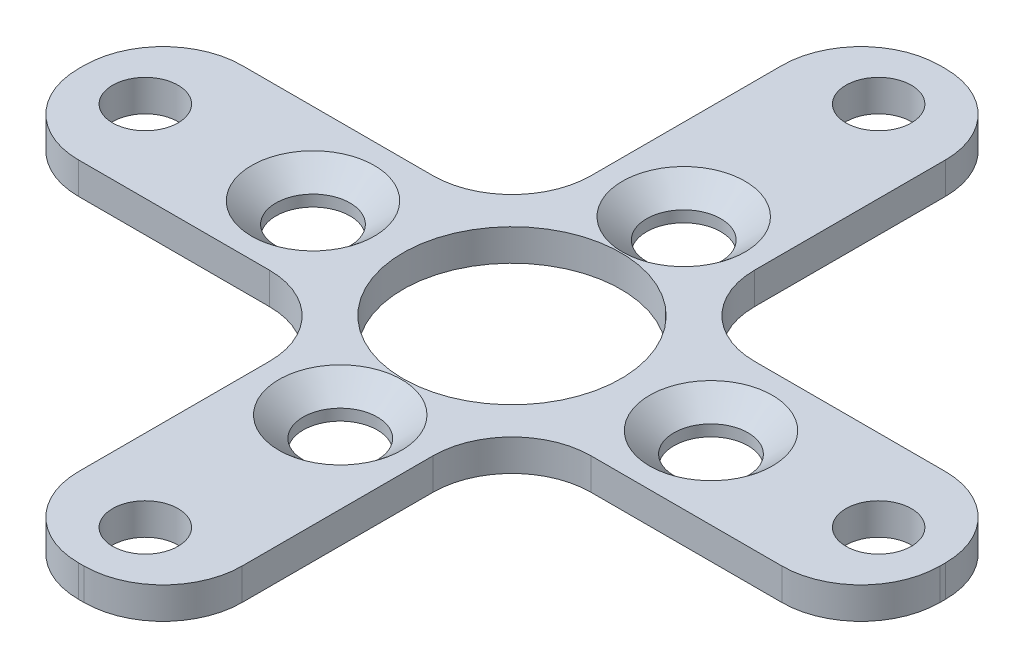
from build123d import *

# Parameters (mm, degrees)
SKETCH1_R                                         = 5.08
SKETCH1_R_2                                       = 1.524
BOSS_EXTRUDE1_DEPTH                               = 1.4732
CSK_FOR_4_FLAT_HEAD_MACHINE_SCREW_100_D           = 3.4544
CSK_FOR_4_FLAT_HEAD_MACHINE_SCREW_100_DEPTH       = 3.44932
CSK_FOR_4_FLAT_HEAD_MACHINE_SCREW_100_CSINK_D     = 5.715
CSK_FOR_4_FLAT_HEAD_MACHINE_SCREW_100_CSINK_ANGLE = 100
CSK_FOR_4_FLAT_HEAD_MACHINE_SCREW_100_TIP         = 1.037806461


with BuildPart() as part:
    # Sketch1 → Boss-Extrude1 (new body)
    with BuildSketch(Plane(origin=(0, 0, 0), x_dir=(1, 0, 0), z_dir=(0, 1, 0))):
        with BuildLine():
            Line((-3.81, 7.493), (-3.81, 16.383))
            ThreePointArc((-3.81, 16.383), (-2.731274275, 18.987274275), (-0.127, 20.066))
            Line((-0.127, 20.066), (0.127, 20.066))
            ThreePointArc((0.127, 20.066), (2.731274275, 18.987274275), (3.81, 16.383))
            Line((3.81, 16.383), (3.81, 7.493))
            ThreePointArc((3.81, 7.493), (4.888725725, 4.888725725), (7.493, 3.81))
            Line((7.493, 3.81), (16.383, 3.81))
            ThreePointArc((16.383, 3.81), (18.987274275, 2.731274275), (20.066, 0.127))
            Line((20.066, 0.127), (20.066, -0.127))
            ThreePointArc((20.066, -0.127), (18.987274275, -2.731274275), (16.383, -3.81))
            Line((16.383, -3.81), (7.493, -3.81))
            ThreePointArc((7.493, -3.81), (4.888725725, -4.888725725), (3.81, -7.493))
            Line((3.81, -7.493), (3.81, -16.383))
            ThreePointArc((3.81, -16.383), (2.731274275, -18.987274275), (0.127, -20.066))
            Line((0.127, -20.066), (-0.127, -20.066))
            ThreePointArc((-0.127, -20.066), (-2.731274275, -18.987274275), (-3.81, -16.383))
            Line((-3.81, -16.383), (-3.81, -7.493))
            ThreePointArc((-3.81, -7.493), (-4.888725725, -4.888725725), (-7.493, -3.81))
            Line((-7.493, -3.81), (-16.383, -3.81))
            ThreePointArc((-16.383, -3.81), (-18.987274275, -2.731274275), (-20.066, -0.127))
            Line((-20.066, -0.127), (-20.066, 0.127))
            ThreePointArc((-20.066, 0.127), (-18.987274275, 2.731274275), (-16.383, 3.81))
            Line((-16.383, 3.81), (-7.493, 3.81))
            ThreePointArc((-7.493, 3.81), (-4.888725725, 4.888725725), (-3.81, 7.493))
        make_face()
        with Locations(Location((0, 0, 0), (0, 0, 270))):
            Circle(SKETCH1_R, mode=Mode.SUBTRACT)
        with Locations(Location((0, 17.0815, 0), (0, 0, 270))):
            Circle(SKETCH1_R_2, mode=Mode.SUBTRACT)
        with Locations(Location((17.0815, 0, 0), (0, 0, 270))):
            Circle(SKETCH1_R_2, mode=Mode.SUBTRACT)
        with Locations(Location((-17.0815, 0, 0), (0, 0, 270))):
            Circle(SKETCH1_R_2, mode=Mode.SUBTRACT)
        with Locations(Location((0, -17.0815, 0), (0, 0, 270))):
            Circle(SKETCH1_R_2, mode=Mode.SUBTRACT)
    extrude(amount=BOSS_EXTRUDE1_DEPTH)

    # CSK for #4 Flat Head Machine Screw (100)2
    with Locations(Plane(origin=(0, 1.4732, 0), x_dir=(1, 0, 0), z_dir=(0, 1, 0))):
        with Locations((0, 8.001), (0, -8.001), (9.271, 0), (-9.271, 0)):
            CounterSinkHole(CSK_FOR_4_FLAT_HEAD_MACHINE_SCREW_100_D / 2, CSK_FOR_4_FLAT_HEAD_MACHINE_SCREW_100_CSINK_D / 2, depth=CSK_FOR_4_FLAT_HEAD_MACHINE_SCREW_100_DEPTH, counter_sink_angle=CSK_FOR_4_FLAT_HEAD_MACHINE_SCREW_100_CSINK_ANGLE)
            with Locations((0, 0, -(CSK_FOR_4_FLAT_HEAD_MACHINE_SCREW_100_DEPTH + CSK_FOR_4_FLAT_HEAD_MACHINE_SCREW_100_TIP / 2))):  # 118° drill point
                Cone(0, CSK_FOR_4_FLAT_HEAD_MACHINE_SCREW_100_D / 2, CSK_FOR_4_FLAT_HEAD_MACHINE_SCREW_100_TIP, mode=Mode.SUBTRACT)


solid = part.part
